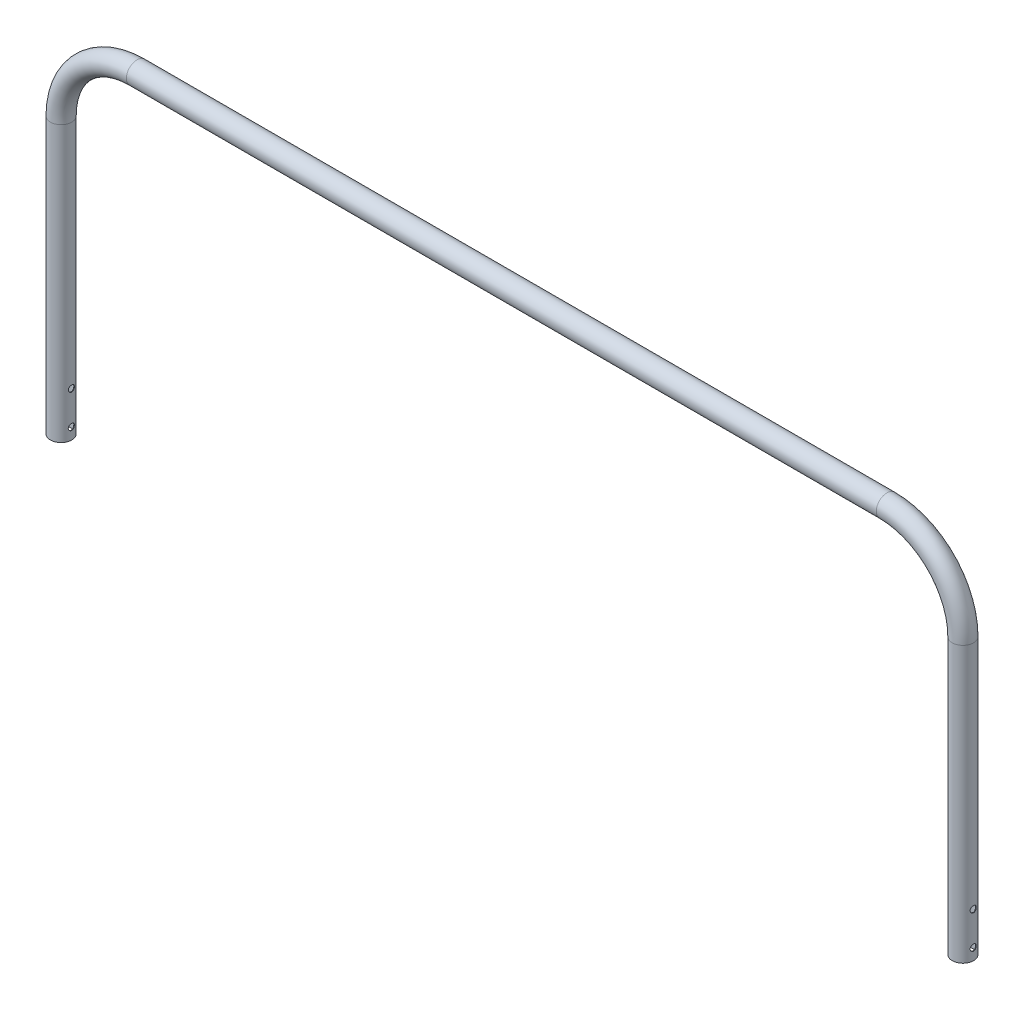
from build123d import *

# Parameters (mm, degrees)
SKETCH2_R               = 11.25
SKETCH2_R_2             = 10.65
CUT_EXTRUDE1_DEPTH      = 1035.156510288
CUT_EXTRUDE1_DEPTH_BACK = 1035.156510288
SKETCH3_R               = 3.238231215


with BuildPart() as part:
    # Sweep1: sweep along a path in Sketch1
    with BuildLine(Plane.XY) as sweep1_path:
        Line((0, 0), (0, 290))
        ThreePointArc((0, 290), (23.431457505, 346.568542495), (80, 370))
        Line((80, 370), (870, 370))
        ThreePointArc((870, 370), (926.568542495, 346.568542495), (950, 290))
        Line((950, 290), (950, 0))
    # Sketch2 → Sweep1 (sweep)
    with BuildSketch(Plane(origin=(0, 0, 0), x_dir=(1, 0, 0), z_dir=(0, 1, 0))):
        Circle(SKETCH2_R)
        Circle(SKETCH2_R_2, mode=Mode.SUBTRACT)
    sweep(path=sweep1_path.line)

    # Sketch3 → Cut-Extrude1 (cut, two sides: drawn at the far end of the back side and taken through both)
    with BuildSketch(Plane(origin=(0, 0, 0), x_dir=(0, 0, -1), z_dir=(1, 0, 0)).offset(-CUT_EXTRUDE1_DEPTH_BACK)):
        with Locations((0, 12)):
            Circle(SKETCH3_R)
        with Locations((0, 47)):
            Circle(SKETCH3_R)
    extrude(amount=CUT_EXTRUDE1_DEPTH + CUT_EXTRUDE1_DEPTH_BACK, mode=Mode.SUBTRACT)


solid = part.part
